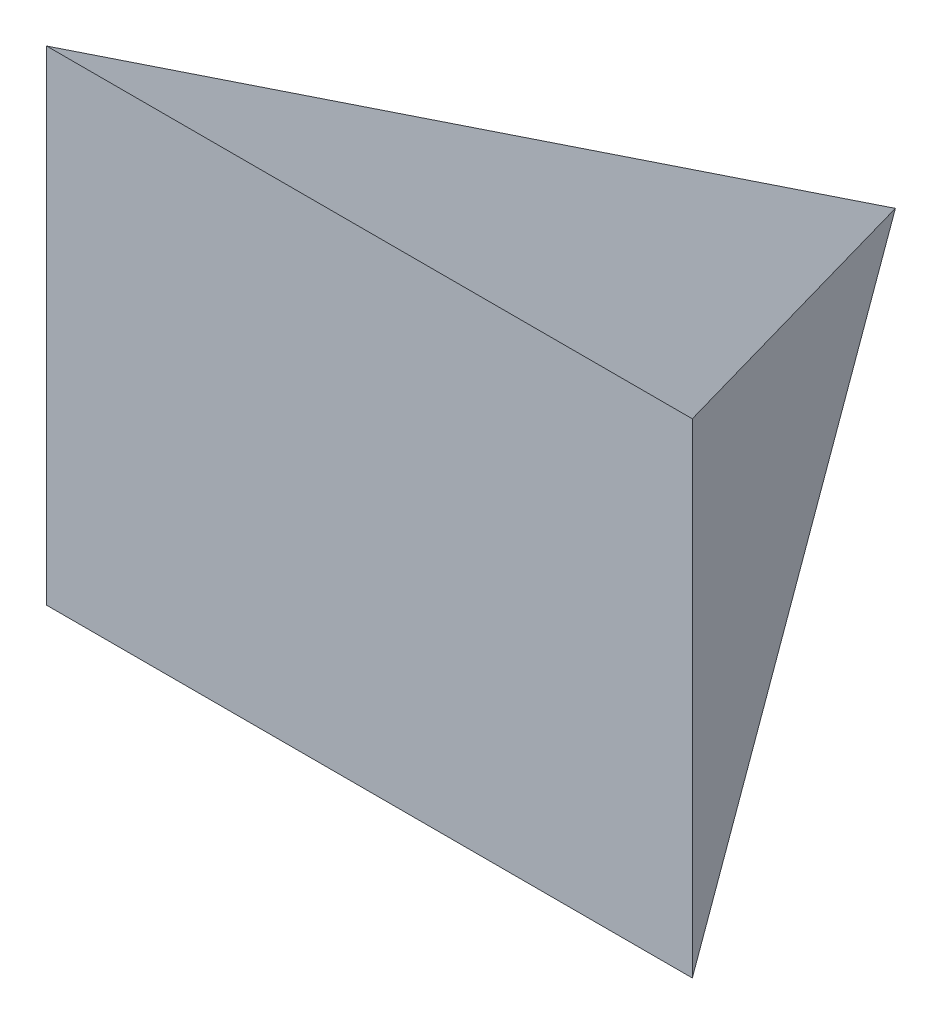
from build123d import *

# Parameters (mm, degrees)
ESQUISSE4_W             = 400
ESQUISSE4_H             = 300
BOSS_EXTRU_1_DEPTH      = 325.81
ENL_V_MAT_EXTRU_1_DEPTH = 597.784849087
ENL_V_MAT_EXTRU_3_DEPTH = 758.184749953


with BuildPart() as part:
    # Esquisse4 → Boss.-Extru.1 (new body)
    with BuildSketch(Plane.XY):
        with Locations((200, 237.392658036)):
            Rectangle(ESQUISSE4_W, ESQUISSE4_H)
    extrude(amount=-BOSS_EXTRU_1_DEPTH)

    # Esquisse9 → Enlèv. mat.-Extru.1 (cut, through all)
    with BuildSketch(Plane(origin=(0, 387.392658036, 0), x_dir=(1, 0, 0), z_dir=(0, 1, 0))):
        Polygon((0, 0), (200, 325.81), (400, 0), (400, 335.81), (0, 335.81), align=None)
    extrude(amount=-ENL_V_MAT_EXTRU_1_DEPTH, mode=Mode.SUBTRACT)

    # Esquisse10 → Enlèv. mat.-Extru.3 (cut, through all, along a direction that is not the sketch's normal)
    with BuildSketch(Plane(origin=(0, 0, 0), x_dir=(-0.5231513885267656, 0, 0.8522397694795271), z_dir=(-0.8522397694795271, 0, -0.5231513885267656))):
        Polygon((0, 387.392658036), (-382.298516999, 237.392658036), (0, 87.392658036), (-392.298516999, 87.392658036), (-392.298516999, 387.392658036), align=None)
    extrude(amount=-ENL_V_MAT_EXTRU_3_DEPTH, dir=(-1, 0, 0), mode=Mode.SUBTRACT)


solid = part.part
